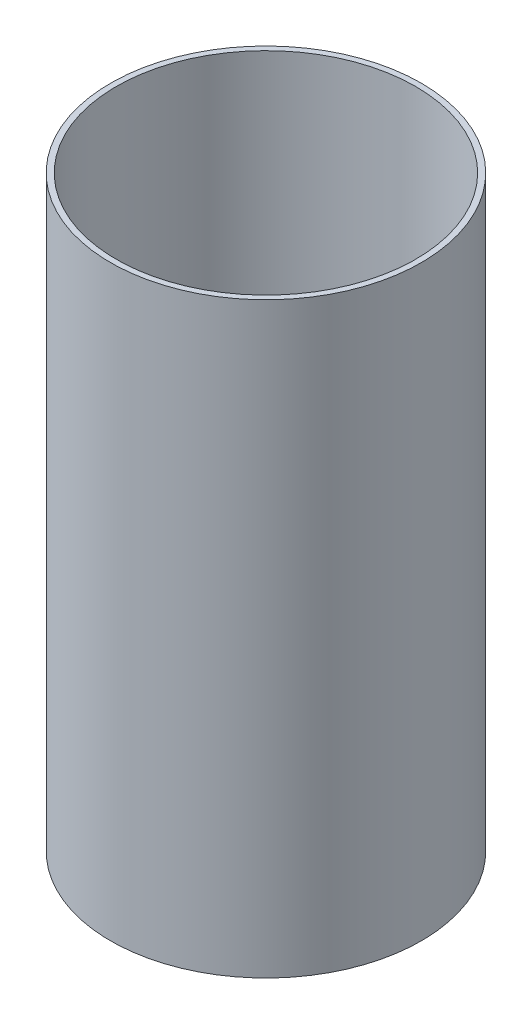
from build123d import *

# Parameters (mm, degrees)
SKETCH1_R           = 44.45
SKETCH1_R_2         = 42.82
BOSS_EXTRUDE1_DEPTH = 168


with BuildPart() as part:
    # Sketch1 → Boss-Extrude1 (new body)
    with BuildSketch(Plane(origin=(0, 0, 0), x_dir=(1, 0, 0), z_dir=(0, 1, 0))):
        with Locations(Location((0, 0, 0), (0, 0, 90))):
            Circle(SKETCH1_R)
        with Locations(Location((0, 0, 0), (0, 0, 90))):
            Circle(SKETCH1_R_2, mode=Mode.SUBTRACT)
    extrude(amount=BOSS_EXTRUDE1_DEPTH)


solid = part.part
